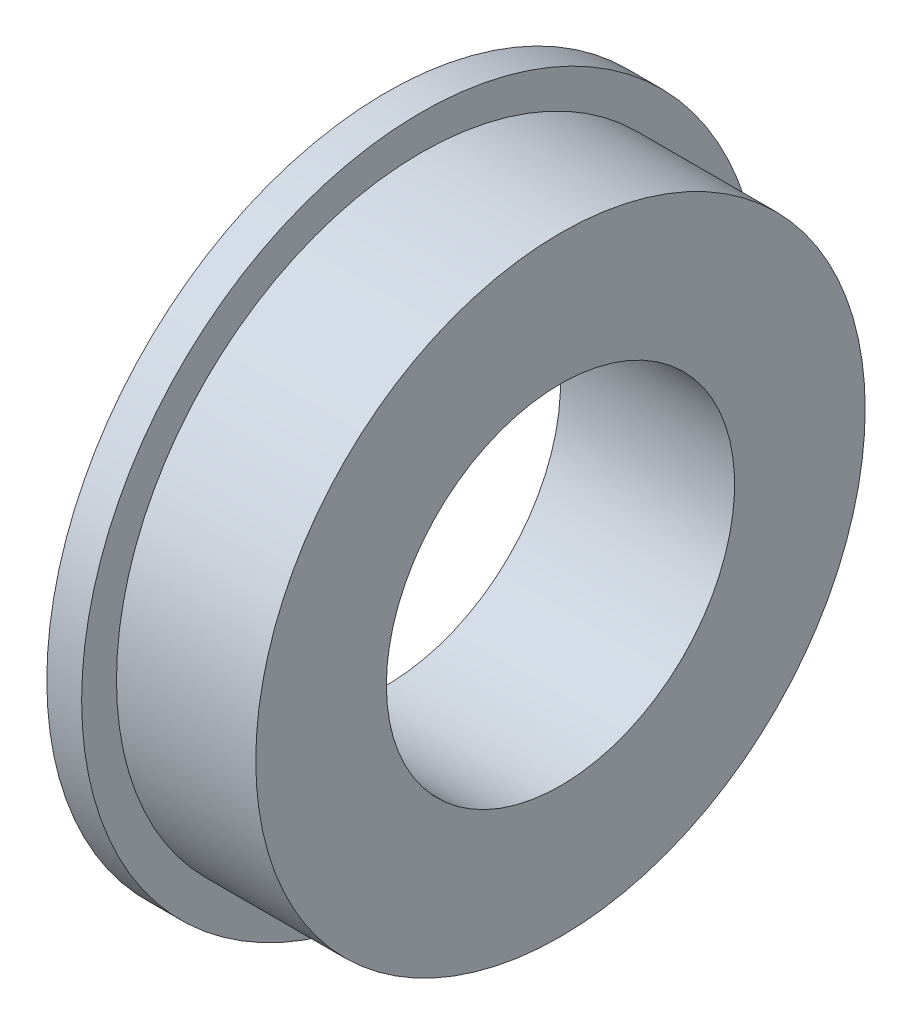
from build123d import *


with BuildPart() as part:
    # 草图1 → 旋转1 (revolve)
    with BuildSketch(Plane.XY, mode=Mode.PRIVATE) as revolve_1_sk:
        Polygon((0, 4), (0, 7.8), (0.8, 7.8), (0.8, 7), (4, 7), (4, 4), align=None)
    revolve(revolve_1_sk.sketch.rotate(Axis((0, 0, 0), (1, 0, 0)), 90), axis=Axis((0, 0, 0), (1, 0, 0)))


solid = part.part
